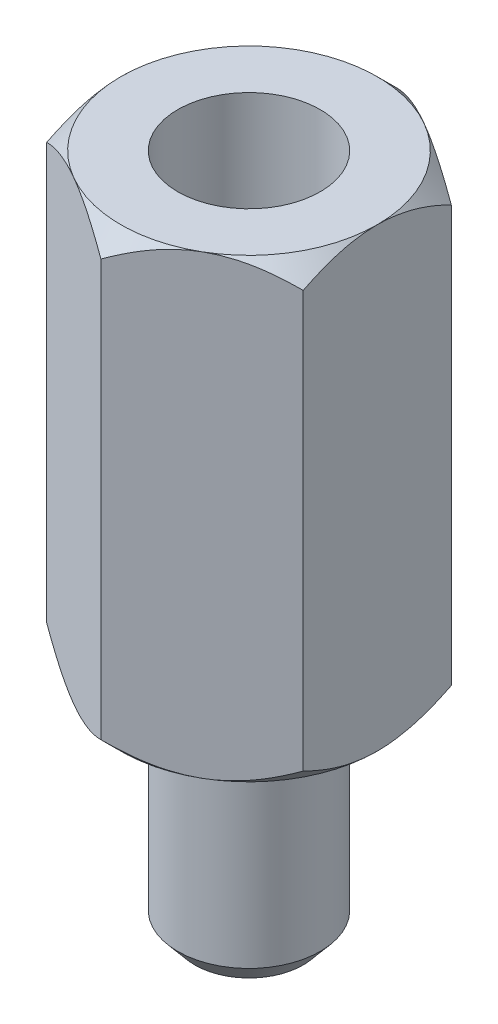
from build123d import *

# Parameters (mm, degrees)
SKETCH1_R           = 1.25
BOSS_EXTRUDE1_DEPTH = 3.9
BOSS_EXTRUDE2_DEPTH = 8
CUT_EXTRUDE1_START  = -4.8
SKETCH3_R           = 1.25
CUT_EXTRUDE1_DEPTH  = 4.8
SKETCH4_OUTSIDE_W   = 36.022
SKETCH4_OUTSIDE_H   = 36.718
SKETCH4_OUTSIDE_R   = 2.25
CUT_EXTRUDE2_DEPTH  = 13.386383653
CUT_EXTRUDE2_DRAFT  = -45
SKETCH5_OUTSIDE_W   = 28.662
SKETCH5_OUTSIDE_H   = 29.358
SKETCH5_OUTSIDE_R   = 2.25
CUT_EXTRUDE3_DEPTH  = 9.707037384
CUT_EXTRUDE3_DRAFT  = -45
CHAMFER1_SIZE       = 0.3
CHAMFER1_SIZE2      = 0.357526078


with BuildPart() as part:
    # Sketch1 → Boss-Extrude1 (new body)
    with BuildSketch(Plane(origin=(0, 0, 0), x_dir=(1, 0, 0), z_dir=(0, 1, 0))):
        with Locations(Location((0, 0, 0), (0, 0, 270))):
            Circle(SKETCH1_R)
    extrude(amount=BOSS_EXTRUDE1_DEPTH)

    # Sketch2 → Boss-Extrude2 (add)
    with BuildSketch(Plane(origin=(0, 3.9, 0), x_dir=(1, 0, 0), z_dir=(0, 1, 0))):
        Polygon((0, -2.598076211), (2.25, -1.299038106), (2.25, 1.299038106), (0, 2.598076211), (-2.25, 1.299038106), (-2.25, -1.299038106), align=None)
    extrude(amount=BOSS_EXTRUDE2_DEPTH)

    # Sketch3 → Cut-Extrude1 (cut)
    with BuildSketch(Plane(origin=(0, 11.9, 0), x_dir=(1, 0, 0), z_dir=(0, 1, 0)).offset(CUT_EXTRUDE1_START)):
        with Locations(Location((0, 0, 0), (0, 0, 270))):
            Circle(SKETCH3_R)
    extrude(amount=CUT_EXTRUDE1_DEPTH, mode=Mode.SUBTRACT)


with BuildPart() as cut_extrude2_tool:
    # Sketch4 outside → Cut-Extrude2 (with draft: the straight prism first)
    with BuildSketch(Plane(origin=(0, 11.9, 0), x_dir=(1, 0, 0), z_dir=(0, 1, 0))):
        Rectangle(SKETCH4_OUTSIDE_W, SKETCH4_OUTSIDE_H)
        Circle(SKETCH4_OUTSIDE_R, mode=Mode.SUBTRACT)
    extrude(amount=-CUT_EXTRUDE2_DEPTH)
    # Cut-Extrude2: the draft: its side faces are tilted about the plane it starts from
    cut_extrude2_sides = [cut_extrude2_tool.faces().sort_by_distance(p)[0] for p in [
        (0, 5.206808173, 18.359),
        (18.011, 5.206808173, 0),
        (0, 5.206808173, -18.359),
        (-18.011, 5.206808173, 0),
        (-2.25, 5.206808173, 0),
    ]]
    draft(cut_extrude2_sides, Plane(origin=(0, 11.9, 0), x_dir=(1, 0, 0), z_dir=(0, 1, 0)), CUT_EXTRUDE2_DRAFT)


with BuildPart() as part_1:
    add(part.part)

    # Cut-Extrude2: cut by cut_extrude2_tool
    add(cut_extrude2_tool.part, mode=Mode.SUBTRACT)


with BuildPart() as cut_extrude3_tool:
    # Sketch5 outside → Cut-Extrude3 (with draft: the straight prism first)
    with BuildSketch(Plane.XZ.offset(-3.9)):
        Rectangle(SKETCH5_OUTSIDE_W, SKETCH5_OUTSIDE_H)
        Circle(SKETCH5_OUTSIDE_R, mode=Mode.SUBTRACT)
    extrude(amount=-CUT_EXTRUDE3_DEPTH)
    # Cut-Extrude3: the draft: its side faces are tilted about the plane it starts from
    cut_extrude3_sides = [cut_extrude3_tool.faces().sort_by_distance(p)[0] for p in [
        (0, 8.753518692, -14.679),
        (14.331, 8.753518692, 0),
        (0, 8.753518692, 14.679),
        (-14.331, 8.753518692, 0),
        (-2.25, 8.753518692, 0),
    ]]
    draft(cut_extrude3_sides, Plane.XZ.offset(-3.9), CUT_EXTRUDE3_DRAFT)


with BuildPart() as part_2:
    add(part_1.part)

    # Cut-Extrude3: cut by cut_extrude3_tool
    add(cut_extrude3_tool.part, mode=Mode.SUBTRACT)

    # Chamfer1
    chamfer1_edges = [part_2.edges().sort_by_distance(p)[0] for p in [
        (0, 0, -1.25),
    ]]
    chamfer1_side = [part_2.faces().sort_by_distance(p)[0] for p in [
        (0, 0, 0),
    ]]
    chamfer(chamfer1_edges, length=CHAMFER1_SIZE, length2=CHAMFER1_SIZE2, reference=chamfer1_side[0])


solid = part_2.part
